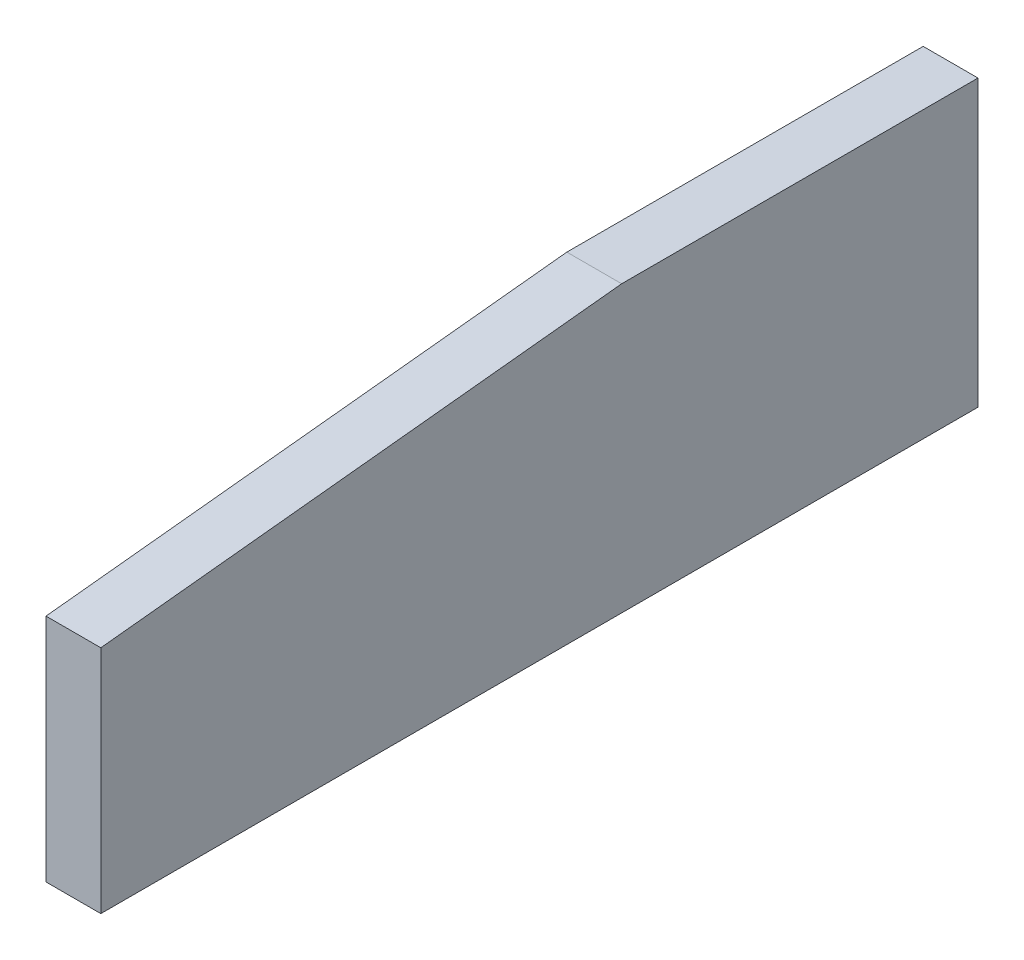
from build123d import *

# Parameters (mm, degrees)
BOSS_EXTRUDE1_DEPTH = 10
SKETCH2_R           = 2
CUT_EXTRUDE1_DEPTH  = 5


with BuildPart() as part:
    # Sketch1 → Boss-Extrude1 (new body)
    with BuildSketch(Plane(origin=(0, 0, 0), x_dir=(0, 0, -1), z_dir=(1, 0, 0))):
        Polygon((-106.339622642, 25.132075472), (-106.339622642, -16.867924528), (53.660377358, -16.867924528), (53.660377358, 35.132075472), (-11.339622642, 35.132075472), align=None)
    extrude(amount=BOSS_EXTRUDE1_DEPTH)

    # Sketch2 → Cut-Extrude1 (cut)
    with BuildSketch(Plane.ZY):
        with Locations((101.339622642, -7.867924528)):
            Circle(SKETCH2_R)
        with Locations((101.339622642, 20.132075472)):
            Circle(SKETCH2_R)
        with Locations((-48.660377358, -7.867924528)):
            Circle(SKETCH2_R)
        with Locations((-48.660377358, 20.132075472)):
            Circle(SKETCH2_R)
    extrude(amount=-CUT_EXTRUDE1_DEPTH, mode=Mode.SUBTRACT)


solid = part.part
